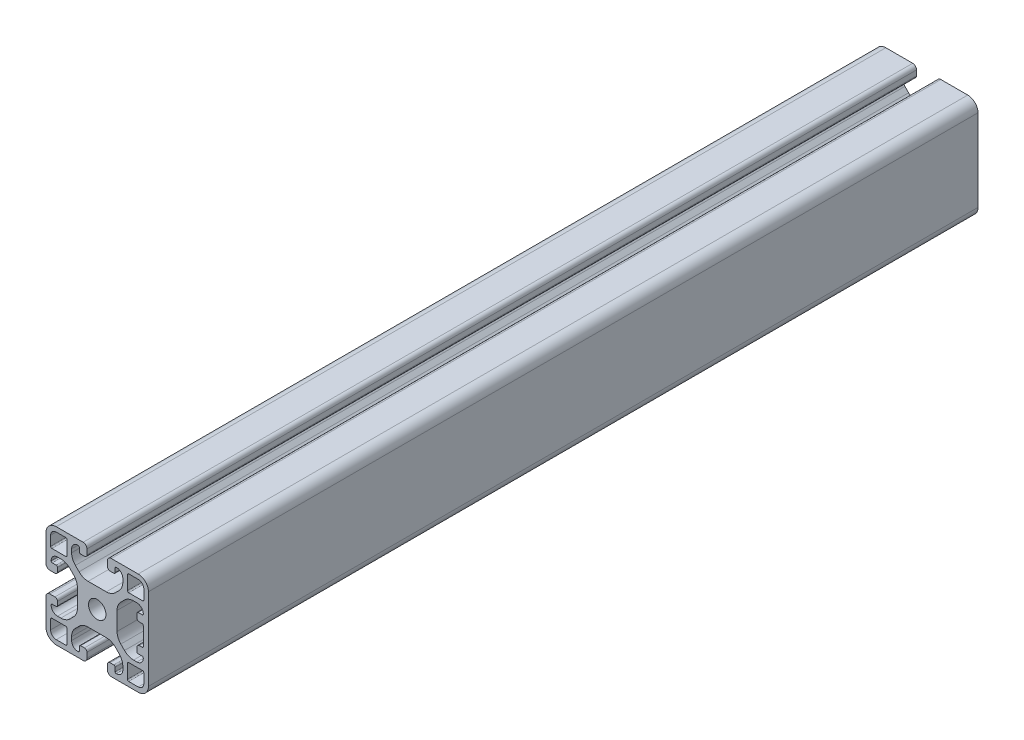
from build123d import *

# Parameters (mm, degrees)
SCHIZZO1_R                   = 3.4
ESTRUSIONE_ESTRUSIONE1_DEPTH = 324


with BuildPart() as part:
    # Schizzo1 → Estrusione-Estrusione1 (new body)
    with BuildSketch(Plane(origin=(0, 0, -340), x_dir=(-1, 0, 0), z_dir=(0, 0, -1))):
        with BuildLine():
            Line((6.5, -15.5), (5, -15.5))
            ThreePointArc((5, -15.5), (4.292893219, -15.792893219), (4, -16.5))
            Line((4, -16.5), (4, -18.5))
            ThreePointArc((4, -18.5), (4.439339828, -19.560660172), (5.5, -20))
            Line((5.5, -20), (16, -20))
            ThreePointArc((16, -20), (18.828427125, -18.828427125), (20, -16))
            Line((20, -16), (20, -5.5))
            ThreePointArc((20, -5.5), (19.560660172, -4.439339828), (18.5, -4))
            Line((18.5, -4), (16.5, -4))
            ThreePointArc((16.5, -4), (15.792893219, -4.292893219), (15.5, -5))
            Line((15.5, -5), (15.5, -6.5))
            ThreePointArc((15.5, -6.5), (15.646446609, -6.853553391), (16, -7))
            Line((16, -7), (17.55, -7))
            ThreePointArc((17.55, -7), (17.868198052, -7.131801948), (18, -7.45))
            Line((18, -7.45), (18, -7.5))
            ThreePointArc((18, -7.5), (17.267766953, -9.267766953), (15.5, -10))
            Line((15.5, -10), (14.192388155, -10))
            ThreePointArc((14.192388155, -10), (12.278970994, -9.619397663), (10.656854249, -8.535533906))
            Line((10.656854249, -8.535533906), (9.214466094, -7.09314575))
            ThreePointArc((9.214466094, -7.09314575), (8.130602337, -5.471029006), (7.75, -3.557611845))
            Line((7.75, -3.557611845), (7.75, 3.557611845))
            ThreePointArc((7.75, 3.557611845), (8.130602337, 5.471029006), (9.214466094, 7.09314575))
            Line((9.214466094, 7.09314575), (10.656854249, 8.535533906))
            ThreePointArc((10.656854249, 8.535533906), (12.278970994, 9.619397663), (14.192388155, 10))
            Line((14.192388155, 10), (15.5, 10))
            ThreePointArc((15.5, 10), (17.267766953, 9.267766953), (18, 7.5))
            Line((18, 7.5), (18, 7.45))
            ThreePointArc((18, 7.45), (17.868198052, 7.131801948), (17.55, 7))
            Line((17.55, 7), (16, 7))
            ThreePointArc((16, 7), (15.646446609, 6.853553391), (15.5, 6.5))
            Line((15.5, 6.5), (15.5, 5))
            ThreePointArc((15.5, 5), (15.792893219, 4.292893219), (16.5, 4))
            Line((16.5, 4), (18.5, 4))
            ThreePointArc((18.5, 4), (19.560660172, 4.439339828), (20, 5.5))
            Line((20, 5.5), (20, 16))
            ThreePointArc((20, 16), (18.828427125, 18.828427125), (16, 20))
            Line((16, 20), (5.5, 20))
            ThreePointArc((5.5, 20), (4.439339828, 19.560660172), (4, 18.5))
            Line((4, 18.5), (4, 16.5))
            ThreePointArc((4, 16.5), (4.292893219, 15.792893219), (5, 15.5))
            Line((5, 15.5), (6.5, 15.5))
            ThreePointArc((6.5, 15.5), (6.853553391, 15.646446609), (7, 16))
            Line((7, 16), (7, 17.55))
            ThreePointArc((7, 17.55), (7.131801948, 17.868198052), (7.45, 18))
            Line((7.45, 18), (7.5, 18))
            ThreePointArc((7.5, 18), (9.267766953, 17.267766953), (10, 15.5))
            Line((10, 15.5), (10, 14.192388155))
            ThreePointArc((10, 14.192388155), (9.619397663, 12.278970994), (8.535533906, 10.656854249))
            Line((8.535533906, 10.656854249), (7.09314575, 9.214466094))
            ThreePointArc((7.09314575, 9.214466094), (5.471029006, 8.130602337), (3.557611844, 7.75))
            Line((3.557611844, 7.75), (-3.557611845, 7.75))
            ThreePointArc((-3.557611845, 7.75), (-5.471029006, 8.130602337), (-7.09314575, 9.214466094))
            Line((-7.09314575, 9.214466094), (-8.535533906, 10.656854249))
            ThreePointArc((-8.535533906, 10.656854249), (-9.619397663, 12.278970994), (-10, 14.192388155))
            Line((-10, 14.192388155), (-10, 15.5))
            ThreePointArc((-10, 15.5), (-9.267766953, 17.267766953), (-7.5, 18))
            Line((-7.5, 18), (-7.45, 18))
            ThreePointArc((-7.45, 18), (-7.131801948, 17.868198052), (-7, 17.55))
            Line((-7, 17.55), (-7, 16))
            ThreePointArc((-7, 16), (-6.853553391, 15.646446609), (-6.5, 15.5))
            Line((-6.5, 15.5), (-5, 15.5))
            ThreePointArc((-5, 15.5), (-4.292893219, 15.792893219), (-4, 16.5))
            Line((-4, 16.5), (-4, 18.5))
            ThreePointArc((-4, 18.5), (-4.439339828, 19.560660172), (-5.5, 20))
            Line((-5.5, 20), (-16, 20))
            ThreePointArc((-16, 20), (-18.828427125, 18.828427125), (-20, 16))
            Line((-20, 16), (-20, -16))
            ThreePointArc((-20, -16), (-18.828427125, -18.828427125), (-16, -20))
            Line((-16, -20), (-5.5, -20))
            ThreePointArc((-5.5, -20), (-4.439339828, -19.560660172), (-4, -18.5))
            Line((-4, -18.5), (-4, -16.5))
            ThreePointArc((-4, -16.5), (-4.292893219, -15.792893219), (-5, -15.5))
            Line((-5, -15.5), (-6.5, -15.5))
            ThreePointArc((-6.5, -15.5), (-6.853553391, -15.646446609), (-7, -16))
            Line((-7, -16), (-7, -17.55))
            ThreePointArc((-7, -17.55), (-7.131801948, -17.868198052), (-7.45, -18))
            Line((-7.45, -18), (-7.5, -18))
            ThreePointArc((-7.5, -18), (-9.267766953, -17.267766953), (-10, -15.5))
            Line((-10, -15.5), (-10, -14.192388155))
            ThreePointArc((-10, -14.192388155), (-9.619397663, -12.278970994), (-8.535533906, -10.656854249))
            Line((-8.535533906, -10.656854249), (-7.09314575, -9.214466094))
            ThreePointArc((-7.09314575, -9.214466094), (-5.471029006, -8.130602337), (-3.557611845, -7.75))
            Line((-3.557611845, -7.75), (3.557611845, -7.75))
            ThreePointArc((3.557611845, -7.75), (5.471029006, -8.130602337), (7.09314575, -9.214466094))
            Line((7.09314575, -9.214466094), (8.535533906, -10.656854249))
            ThreePointArc((8.535533906, -10.656854249), (9.619397663, -12.278970994), (10, -14.192388155))
            Line((10, -14.192388155), (10, -15.5))
            ThreePointArc((10, -15.5), (9.267766953, -17.267766953), (7.5, -18))
            Line((7.5, -18), (7.45, -18))
            ThreePointArc((7.45, -18), (7.131801948, -17.868198052), (7, -17.55))
            Line((7, -17.55), (7, -16))
            ThreePointArc((7, -16), (6.853553391, -15.646446609), (6.5, -15.5))
        make_face()
        with Locations(Location((0, 0, 0), (0, 0, 180))):
            Circle(SCHIZZO1_R, mode=Mode.SUBTRACT)
        with BuildLine():
            Line((-12.3, -18.2), (-16, -18.2))
            ThreePointArc((-16, -18.2), (-17.555634919, -17.555634919), (-18.2, -16))
            Line((-18.2, -16), (-18.2, -12.3))
            ThreePointArc((-18.2, -12.3), (-18.053553391, -11.946446609), (-17.7, -11.8))
            Line((-17.7, -11.8), (-12.3, -11.8))
            ThreePointArc((-12.3, -11.8), (-11.946446609, -11.946446609), (-11.8, -12.3))
            Line((-11.8, -12.3), (-11.8, -17.7))
            ThreePointArc((-11.8, -17.7), (-11.946446609, -18.053553391), (-12.3, -18.2))
        make_face(mode=Mode.SUBTRACT)
        with BuildLine():
            Line((-11.8, 17.7), (-11.8, 12.3))
            ThreePointArc((-11.8, 12.3), (-11.946446609, 11.946446609), (-12.3, 11.8))
            Line((-12.3, 11.8), (-17.7, 11.8))
            ThreePointArc((-17.7, 11.8), (-18.053553391, 11.946446609), (-18.2, 12.3))
            Line((-18.2, 12.3), (-18.2, 16))
            ThreePointArc((-18.2, 16), (-17.555634919, 17.555634919), (-16, 18.2))
            Line((-16, 18.2), (-12.3, 18.2))
            ThreePointArc((-12.3, 18.2), (-11.946446609, 18.053553391), (-11.8, 17.7))
        make_face(mode=Mode.SUBTRACT)
        with BuildLine():
            Line((18.2, 16), (18.2, 12.3))
            ThreePointArc((18.2, 12.3), (18.053553391, 11.946446609), (17.7, 11.8))
            Line((17.7, 11.8), (12.3, 11.8))
            ThreePointArc((12.3, 11.8), (11.946446609, 11.946446609), (11.8, 12.3))
            Line((11.8, 12.3), (11.8, 17.7))
            ThreePointArc((11.8, 17.7), (11.946446609, 18.053553391), (12.3, 18.2))
            Line((12.3, 18.2), (16, 18.2))
            ThreePointArc((16, 18.2), (17.555634919, 17.555634919), (18.2, 16))
        make_face(mode=Mode.SUBTRACT)
        with BuildLine():
            Line((18.2, -12.3), (18.2, -16))
            ThreePointArc((18.2, -16), (17.555634919, -17.555634919), (16, -18.2))
            Line((16, -18.2), (12.3, -18.2))
            ThreePointArc((12.3, -18.2), (11.946446609, -18.053553391), (11.8, -17.7))
            Line((11.8, -17.7), (11.8, -12.3))
            ThreePointArc((11.8, -12.3), (11.946446609, -11.946446609), (12.3, -11.8))
            Line((12.3, -11.8), (17.7, -11.8))
            ThreePointArc((17.7, -11.8), (18.053553391, -11.946446609), (18.2, -12.3))
        make_face(mode=Mode.SUBTRACT)
        with BuildLine():
            Line((-16, 7), (-17.5, 7))
            ThreePointArc((-17.5, 7), (-17.853553391, 7.146446609), (-18, 7.5))
            ThreePointArc((-18, 7.5), (-17.267766953, 9.267766953), (-15.5, 10))
            Line((-15.5, 10), (-14.192388155, 10))
            ThreePointArc((-14.192388155, 10), (-12.278970994, 9.619397663), (-10.656854249, 8.535533906))
            Line((-10.656854249, 8.535533906), (-9.214466094, 7.093145751))
            ThreePointArc((-9.214466094, 7.093145751), (-8.130602337, 5.471029006), (-7.75, 3.557611845))
            Line((-7.75, 3.557611845), (-7.75, -3.557611845))
            ThreePointArc((-7.75, -3.557611845), (-8.130602337, -5.471029006), (-9.214466094, -7.093145751))
            Line((-9.214466094, -7.093145751), (-10.656854249, -8.535533906))
            ThreePointArc((-10.656854249, -8.535533906), (-12.278970994, -9.619397663), (-14.192388155, -10))
            Line((-14.192388155, -10), (-15.5, -10))
            ThreePointArc((-15.5, -10), (-17.267766953, -9.267766953), (-18, -7.5))
            ThreePointArc((-18, -7.5), (-17.853553391, -7.146446609), (-17.5, -7))
            Line((-17.5, -7), (-16, -7))
            ThreePointArc((-16, -7), (-15.646446609, -6.853553391), (-15.5, -6.5))
            Line((-15.5, -6.5), (-15.5, -5))
            ThreePointArc((-15.5, -5), (-15.792893219, -4.292893219), (-16.5, -4))
            Line((-16.5, -4), (-17.5, -4))
            ThreePointArc((-17.5, -4), (-17.853553391, -3.853553391), (-18, -3.5))
            Line((-18, -3.5), (-18, 3.5))
            ThreePointArc((-18, 3.5), (-17.853553391, 3.853553391), (-17.5, 4))
            Line((-17.5, 4), (-16.5, 4))
            ThreePointArc((-16.5, 4), (-15.792893219, 4.292893219), (-15.5, 5))
            Line((-15.5, 5), (-15.5, 6.5))
            ThreePointArc((-15.5, 6.5), (-15.646446609, 6.853553391), (-16, 7))
        make_face(mode=Mode.SUBTRACT)
    extrude(amount=-ESTRUSIONE_ESTRUSIONE1_DEPTH)


solid = part.part
